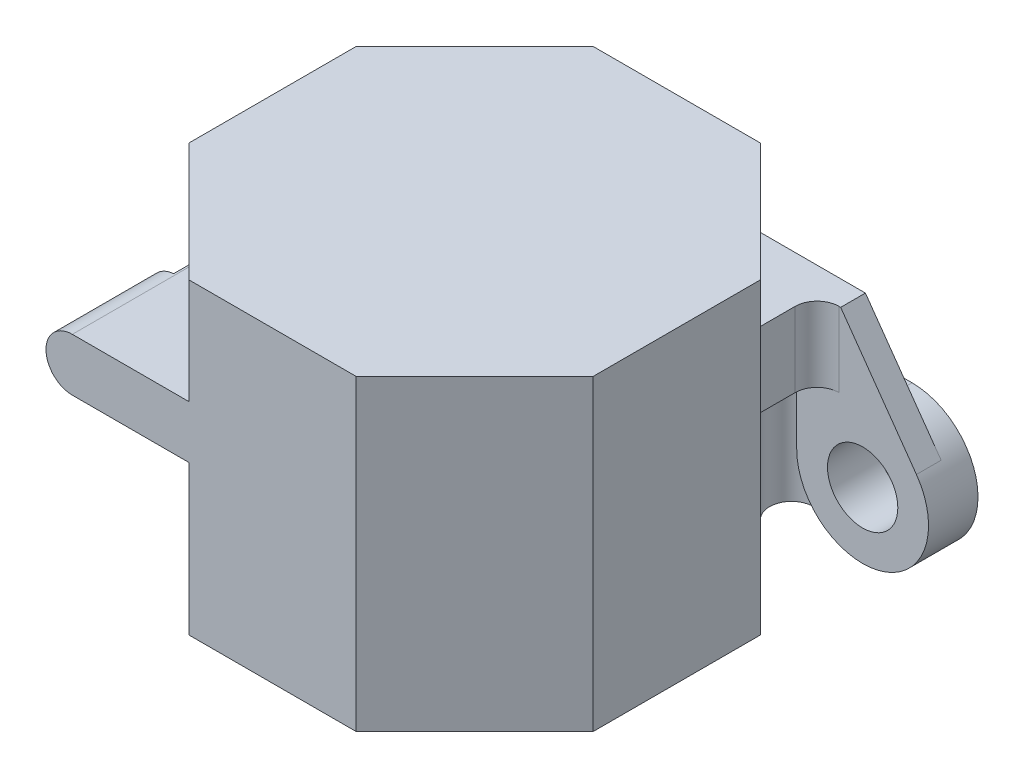
from build123d import *

# Parameters (mm, degrees)
BOSS_EXTRUDE1_DEPTH  = 35.56
SHELL1_T             = -2.032
SKETCH2_R            = 15.24
BOSS_EXTRUDE2_DEPTH  = 3.175
SKETCH3_R            = 4.064
BOSS_EXTRUDE3_DEPTH  = 2.8575
FILLET2_R            = 2.54
SKETCH4_R            = 4.064
BOSS_EXTRUDE10_DEPTH = 2.8575
BOSS_EXTRUDE11_DEPTH = 8.636
FILLET3_R            = 2.54
BOSS_EXTRUDE12_DEPTH = 46.736
SKETCH8_W            = 5.08
SKETCH8_H            = 22.86
CUT_EXTRUDE1_DEPTH   = 55.98528445


with BuildPart() as part:
    # Sketch1 → Boss-Extrude1 (new body)
    with BuildSketch(Plane(origin=(0, 0, 0), x_dir=(1, 0, 0), z_dir=(0, 1, 0))):
        Polygon((9.679342526, -23.368), (23.368, -9.679342526), (23.368, 9.679342526), (9.679342526, 23.368), (-9.679342526, 23.368), (-23.368, 9.679342526), (-23.368, -9.679342526), (-9.679342526, -23.368), align=None)
    extrude(amount=BOSS_EXTRUDE1_DEPTH)

    # Shell1
    shell1_openings = [part.faces().sort_by_distance(p)[0] for p in [
        (0, 0, 0),
    ]]
    offset(amount=SHELL1_T, openings=shell1_openings, kind=Kind.INTERSECTION)

    # Sketch2 → Boss-Extrude2 (add)
    with BuildSketch(Plane.XZ):
        Polygon((23.368, 9.679342526), (9.679342526, 23.368), (-9.679342526, 23.368), (-23.368, 9.679342526), (-23.368, -9.679342526), (-9.679342526, -23.368), (9.679342526, -23.368), (23.368, -9.679342526), align=None)
        with Locations(Location((0, 0, 0), (0, 0, 270))):
            Circle(SKETCH2_R, mode=Mode.SUBTRACT)
    extrude(amount=-BOSS_EXTRUDE2_DEPTH)

    # Sketch3 → Boss-Extrude3 (add)
    with BuildSketch(Plane(origin=(0, 0, -23.368), x_dir=(-1, 0, 0), z_dir=(0, 0, -1))):
        with BuildLine():
            Line((-9.679342526, 5.08), (-27.205342526, 5.08))
            ThreePointArc((-27.205342526, 5.08), (-34.825342526, 12.7), (-27.205342526, 20.32))
            Line((-27.205342526, 20.32), (-9.679342526, 20.32))
            Line((-9.679342526, 20.32), (-9.679342526, 5.08))
        make_face()
        with Locations((-27.205342526, 12.7)):
            Circle(SKETCH3_R, mode=Mode.SUBTRACT)
    extrude(amount=-BOSS_EXTRUDE3_DEPTH)

    # Fillet2
    fillet2_edges = [part.edges().sort_by_distance(p)[0] for p in [
        (12.536842526, 12.7, -20.5105),
    ]]
    fillet(fillet2_edges, radius=FILLET2_R)

    # Sketch4 → Boss-Extrude10 (add)
    with BuildSketch(Plane.XY.offset(-20.5105)):
        with BuildLine():
            Line((12.981342526, 19.304), (12.981342526, 29.464))
            Line((12.981342526, 29.464), (24.665342526, 29.464))
            Line((24.665342526, 29.464), (33.422629122, 17.105649484))
            ThreePointArc((33.422629122, 17.105649484), (29.517124969, 5.439141791), (19.585342526, 12.7))
            Line((19.585342526, 12.7), (19.585342526, 19.304))
            Line((19.585342526, 19.304), (12.981342526, 19.304))
        make_face()
        with Locations(Location((27.205342526, 12.7, 0), (0, 0, 180))):
            Circle(SKETCH4_R, mode=Mode.SUBTRACT)
    extrude(amount=BOSS_EXTRUDE10_DEPTH)

    # Sketch5 → Boss-Extrude11 (add)
    with BuildSketch(Plane(origin=(0, 29.464, 0), x_dir=(1, 0, 0), z_dir=(0, 1, 0))):
        Polygon((12.536842526, 20.5105), (21.934842526, 20.5105), (21.934842526, 11.1125), align=None)
    extrude(amount=-BOSS_EXTRUDE11_DEPTH)

    # Fillet3
    fillet3_edges = [part.edges().sort_by_distance(p)[0] for p in [
        (21.934842526, 25.146, -17.653),
    ]]
    fillet(fillet3_edges, radius=FILLET3_R)

    # Sketch6 → Boss-Extrude12 (add, through all)
    with BuildSketch(Plane.XY.offset(23.368)):
        with BuildLine():
            Line((-9.679342526, 17.272), (-23.141342526, 17.272))
            ThreePointArc((-23.141342526, 17.272), (-26.189342526, 20.32), (-23.141342526, 23.368))
            Line((-23.141342526, 23.368), (-9.679342526, 23.368))
            Line((-9.679342526, 23.368), (-9.679342526, 17.272))
        make_face()
    extrude(amount=-BOSS_EXTRUDE12_DEPTH)

    # Sketch8 → Cut-Extrude1 (cut, through all)
    with BuildSketch(Plane(origin=(0, 35.56, 0), x_dir=(1, 0, 0), z_dir=(0, 1, 0))):
        with Locations((-25.908, 0)):
            Rectangle(SKETCH8_W, SKETCH8_H)
    extrude(amount=-CUT_EXTRUDE1_DEPTH, mode=Mode.SUBTRACT)


solid = part.part
